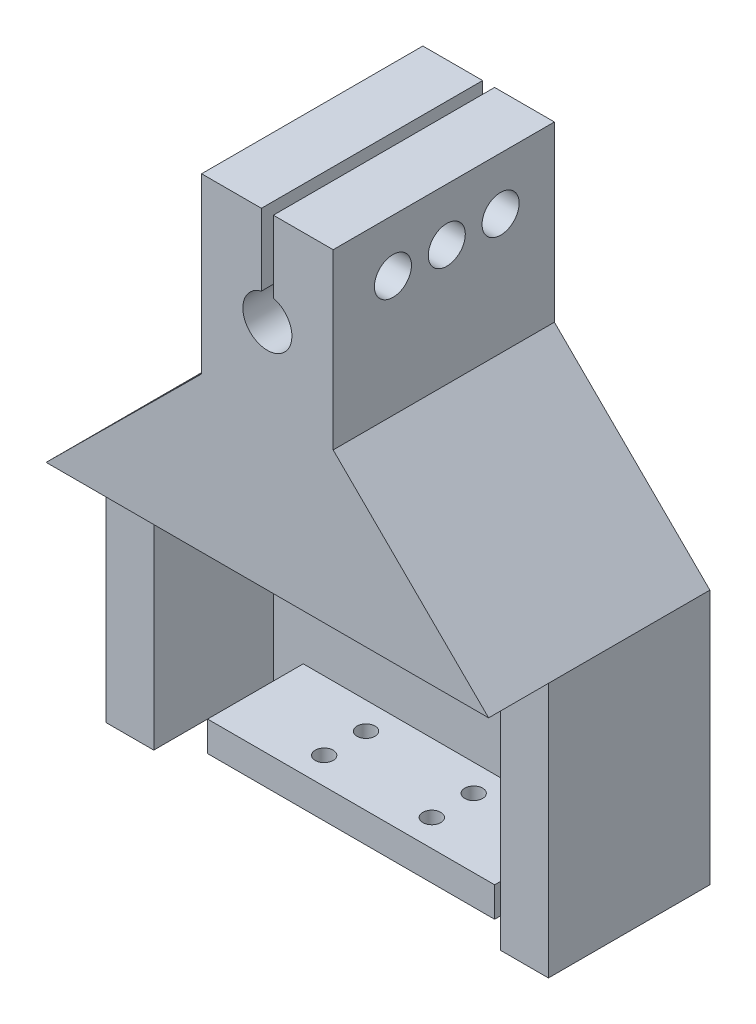
from build123d import *

# Parameters (mm, degrees)
SALIENTE_EXTRUIR1_DEPTH = 7
SALIENTE_EXTRUIR3_DEPTH = 27
SALIENTE_EXTRUIR5_DEPTH = 37
CROQUIS10_R             = 1.9
CORTAR_EXTRUIR3_DEPTH   = 22
CROQUIS11_R             = 3.1
CORTAR_EXTRUIR4_DEPTH   = 6
CORTAR_EXTRUIR5_DEPTH   = 6
CORTAR_EXTRUIR6_START   = -7
CORTAR_EXTRUIR6_DEPTH   = 7
CROQUIS17_4_W           = 8
CROQUIS17_4_H           = 11.32382093
CORTAR_EXTRUIR7_DEPTH   = 20
SALIENTE_EXTRUIR6_DEPTH = 16
CROQUIS18_R             = 1.5
CORTAR_EXTRUIR8_DEPTH   = 10


with BuildPart() as part:
    # Croquis2 → Saliente-Extruir1 (new body)
    with BuildSketch(Plane.XY):
        with BuildLine():
            Line((-47.286620614, 40.816010109), (-47.286620614, -49.183989891))
            ThreePointArc((-47.286620614, -49.183989891), (-45.236368082, -54.133737359), (-40.286620614, -56.183989891))
            Line((-40.286620614, -56.183989891), (3.713379386, -56.183989891))
            ThreePointArc((3.713379386, -56.183989891), (8.663126854, -54.133737359), (10.713379386, -49.183989891))
            Line((10.713379386, -49.183989891), (10.713379386, 40.816010109))
            Line((10.713379386, 40.816010109), (-47.286620614, 40.816010109))
        make_face()
    extrude(amount=SALIENTE_EXTRUIR1_DEPTH)

    # Croquis2<7> → Saliente-Extruir3 (add)
    with BuildSketch(Plane.XY):
        Polygon((-55.286620614, 48.816010109), (-55.286620614, -5.183989891), (-47.286620614, -5.183989891), (-47.286620614, 40.816010109), (10.713379386, 40.816010109), (10.713379386, -5.183989891), (18.713379386, -5.183989891), (18.713379386, 48.816010109), align=None)
    extrude(amount=SALIENTE_EXTRUIR3_DEPTH)

    # Croquis2<14> → Saliente-Extruir5 (add)
    with BuildSketch(Plane.XY):
        with BuildLine():
            Line((-55.286620614, 48.816010109), (-30.786620614, 48.816010109))
            Line((-30.786620614, 48.816010109), (-5.786620614, 48.816010109))
            Line((-5.786620614, 48.816010109), (18.713379386, 48.816010109))
            Line((18.713379386, 48.816010109), (-7.286620614, 74.616010109))
            Line((-7.286620614, 74.616010109), (-7.286620614, 103.616010109))
            Line((-7.286620614, 103.616010109), (-17.286620614, 103.616010109))
            Line((-17.286620614, 103.616010109), (-17.286620614, 91.616010109))
            ThreePointArc((-17.286620614, 91.616010109), (-18.286620614, 83.539831039), (-19.286620614, 91.616010109))
            Line((-19.286620614, 91.616010109), (-19.286620614, 103.616010109))
            Line((-19.286620614, 103.616010109), (-29.286620614, 103.616010109))
            Line((-29.286620614, 103.616010109), (-29.286620614, 74.616010109))
            Line((-29.286620614, 74.616010109), (-55.286620614, 48.816010109))
        make_face()
    extrude(amount=SALIENTE_EXTRUIR5_DEPTH)

    # Croquis10 → Cortar-Extruir3 (cut)
    with BuildSketch(Plane(origin=(-7.286620614, 0, 0), x_dir=(0, 0, -1), z_dir=(1, 0, 0))):
        with Locations((-9, 94.816010109)):
            Circle(CROQUIS10_R)
        with Locations((-18, 94.816010109)):
            Circle(CROQUIS10_R)
        with Locations((-27, 94.816010109)):
            Circle(CROQUIS10_R)
    extrude(amount=-CORTAR_EXTRUIR3_DEPTH, mode=Mode.SUBTRACT)

    # Croquis11 → Cortar-Extruir4 (cut)
    with BuildSketch(Plane(origin=(-7.286620614, 0, 0), x_dir=(0, 0, -1), z_dir=(1, 0, 0))):
        with Locations((-27, 94.816010109)):
            Circle(CROQUIS11_R)
        with Locations((-18, 94.816010109)):
            Circle(CROQUIS11_R)
        with Locations((-9, 94.816010109)):
            Circle(CROQUIS11_R)
    extrude(amount=-CORTAR_EXTRUIR4_DEPTH, mode=Mode.SUBTRACT)

    # Croquis12 → Cortar-Extruir5 (cut)
    with BuildSketch(Plane.ZY.offset(29.286620614)):
        Polygon((21.233161507, 94.816010109), (19.616580754, 97.616010109), (16.383419246, 97.616010109), (14.766838493, 94.816010109), (16.383419246, 92.016010109), (19.616580754, 92.016010109), align=None)
        Polygon((12.233161507, 94.816010109), (10.616580754, 97.616010109), (7.383419246, 97.616010109), (5.766838493, 94.816010109), (7.383419246, 92.016010109), (10.616580754, 92.016010109), align=None)
        Polygon((30.233161507, 94.816010109), (28.616580754, 97.616010109), (25.383419246, 97.616010109), (23.766838493, 94.816010109), (25.383419246, 92.016010109), (28.616580754, 92.016010109), align=None)
    extrude(amount=-CORTAR_EXTRUIR5_DEPTH, mode=Mode.SUBTRACT)

    # Croquis17 → Cortar-Extruir6 (cut)
    with BuildSketch(Plane.XY.offset(7).offset(CORTAR_EXTRUIR6_START)):
        with BuildLine():
            Line((-55.286620614, 6.139831039), (-55.286620614, -5.183989891))
            Line((-55.286620614, -5.183989891), (-47.286620614, -5.183989891))
            Line((-47.286620614, -5.183989891), (-47.286620614, -49.183989891))
            ThreePointArc((-47.286620614, -49.183989891), (-45.236368082, -54.133737359), (-40.286620614, -56.183989891))
            Line((-40.286620614, -56.183989891), (3.713379386, -56.183989891))
            ThreePointArc((3.713379386, -56.183989891), (8.663126854, -54.133737359), (10.713379386, -49.183989891))
            Line((10.713379386, -49.183989891), (10.713379386, -5.183989891))
            Line((10.713379386, -5.183989891), (18.713379386, -5.183989891))
            Line((18.713379386, -5.183989891), (18.713379386, 6.139831039))
            Line((18.713379386, 6.139831039), (-55.286620614, 6.139831039))
        make_face()
    extrude(amount=CORTAR_EXTRUIR6_DEPTH, mode=Mode.SUBTRACT)

    # Croquis17<4> → Cortar-Extruir7 (cut)
    with BuildSketch(Plane.XY.offset(7)):
        with Locations((-51.286620614, 0.477920574)):
            Rectangle(CROQUIS17_4_W, CROQUIS17_4_H)
        with Locations((14.713379386, 0.477920574)):
            Rectangle(CROQUIS17_4_W, CROQUIS17_4_H)
    extrude(amount=CORTAR_EXTRUIR7_DEPTH, mode=Mode.SUBTRACT)

    # Croquis17<5> → Saliente-Extruir6 (add)
    with BuildSketch(Plane.XY.offset(7)):
        Polygon((-42.286620614, 6.139831039), (-18.286620614, 6.139831039), (5.713379386, 6.139831039), (5.713379386, 11.139831039), (-42.286620614, 11.139831039), align=None)
    extrude(amount=SALIENTE_EXTRUIR6_DEPTH)

    # Croquis18 → Cortar-Extruir8 (cut)
    with BuildSketch(Plane.XZ.offset(-6.139831039)):
        with Locations((-27.286620614, 18.5)):
            Circle(CROQUIS18_R)
        with Locations((-9.286620614, 18.5)):
            Circle(CROQUIS18_R)
        with Locations((-27.286620614, 11.5)):
            Circle(CROQUIS18_R)
        with Locations((-9.286620614, 11.5)):
            Circle(CROQUIS18_R)
    extrude(amount=-CORTAR_EXTRUIR8_DEPTH, mode=Mode.SUBTRACT)


solid = part.part
